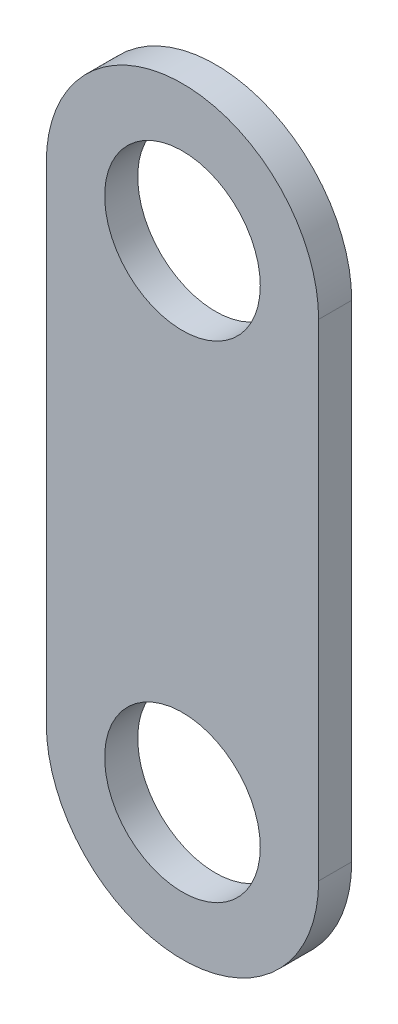
from build123d import *

# Parameters (mm, degrees)
CROQUIS1_R              = 4
SALIENTE_EXTRUIR1_DEPTH = 1.7


with BuildPart() as part:
    # Croquis1 → Saliente-Extruir1 (new body)
    with BuildSketch(Plane.XY):
        with BuildLine():
            Line((-7, 25), (-7, 0))
            ThreePointArc((-7, 0), (0, -7), (7, 0))
            Line((7, 0), (7, 25))
            ThreePointArc((7, 25), (0, 32), (-7, 25))
        make_face()
        Circle(CROQUIS1_R, mode=Mode.SUBTRACT)
        with BuildLine():
            ThreePointArc((4, 25), (0, 29), (-4, 25))
            ThreePointArc((-4, 25), (0, 21), (4, 25))
        make_face(mode=Mode.SUBTRACT)
    extrude(amount=SALIENTE_EXTRUIR1_DEPTH)


solid = part.part
